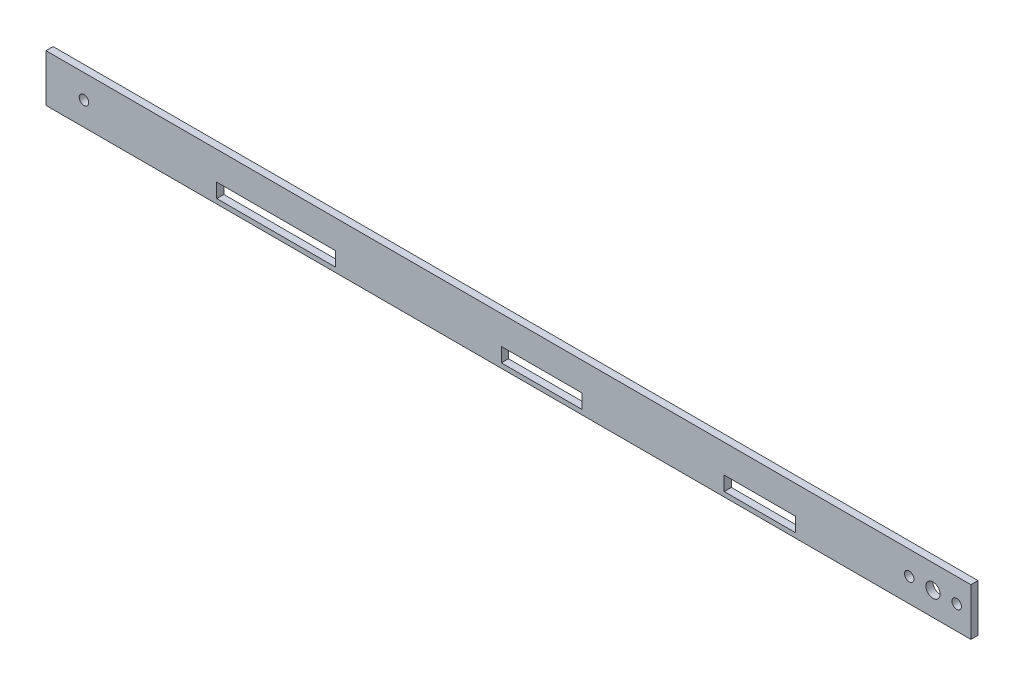
from build123d import *

# Parameters (mm, degrees)
SKETCH_1_W               = 195
SKETCH_1_H               = 10
EXTRUDE_1_DEPTH          = 1.5
CUT_EXTRUDE_1_DEPTH      = 12
CUT_EXTRUDE_1_DEPTH_BACK = 15
CUT_EXTRUDE_2_DEPTH      = 32
CUT_EXTRUDE_2_DEPTH_BACK = 31
SKETCH_3_R               = 1.5
SKETCH_3_R_2             = 1
SKETCH_4_W               = 15
SKETCH_4_H               = 3
SKETCH_4_W_2             = 17
SKETCH_4_W_3             = 25
CUT_EXTRUDE_3_DEPTH      = 10


with BuildPart() as part:
    # 草图1 → 凸台-拉伸1 (new body)
    with BuildSketch(Plane.XY):
        with Locations((-102.5, -5)):
            Rectangle(SKETCH_1_W, SKETCH_1_H)
    extrude(amount=EXTRUDE_1_DEPTH)

    # 草图2 → 切除-拉伸1 (cut, two sides: drawn at the far end of the back side and taken through both)
    with BuildSketch(Plane.XY.offset(1.5).offset(-CUT_EXTRUDE_1_DEPTH_BACK)):
        with BuildLine():
            ThreePointArc((-193, -5), (-192, -6), (-191, -5))
            ThreePointArc((-191, -5), (-192, -4), (-193, -5))
        make_face()
    extrude(amount=CUT_EXTRUDE_1_DEPTH + CUT_EXTRUDE_1_DEPTH_BACK, mode=Mode.SUBTRACT)

    # 草图3 → 切除-拉伸2 (cut, two sides: drawn at the far end of the back side and taken through both)
    with BuildSketch(Plane.XY.offset(1.5).offset(-CUT_EXTRUDE_2_DEPTH_BACK)):
        with Locations((-13, -5)):
            Circle(SKETCH_3_R)
        with Locations((-8, -5)):
            Circle(SKETCH_3_R_2)
        with Locations((-18, -5)):
            Circle(SKETCH_3_R_2)
    extrude(amount=CUT_EXTRUDE_2_DEPTH + CUT_EXTRUDE_2_DEPTH_BACK, mode=Mode.SUBTRACT)

    # 草图4 → 切除-拉伸3 (cut)
    with BuildSketch(Plane(origin=(0, 0, 0), x_dir=(-1, 0, 0), z_dir=(0, 0, -1))):
        with Locations((49.5, -7.5)):
            Rectangle(SKETCH_4_W, SKETCH_4_H)
        with Locations((95.5, -7.5)):
            Rectangle(SKETCH_4_W_2, SKETCH_4_H)
        with Locations((151.5, -7.5)):
            Rectangle(SKETCH_4_W_3, SKETCH_4_H)
    extrude(amount=-CUT_EXTRUDE_3_DEPTH, mode=Mode.SUBTRACT)


solid = part.part
